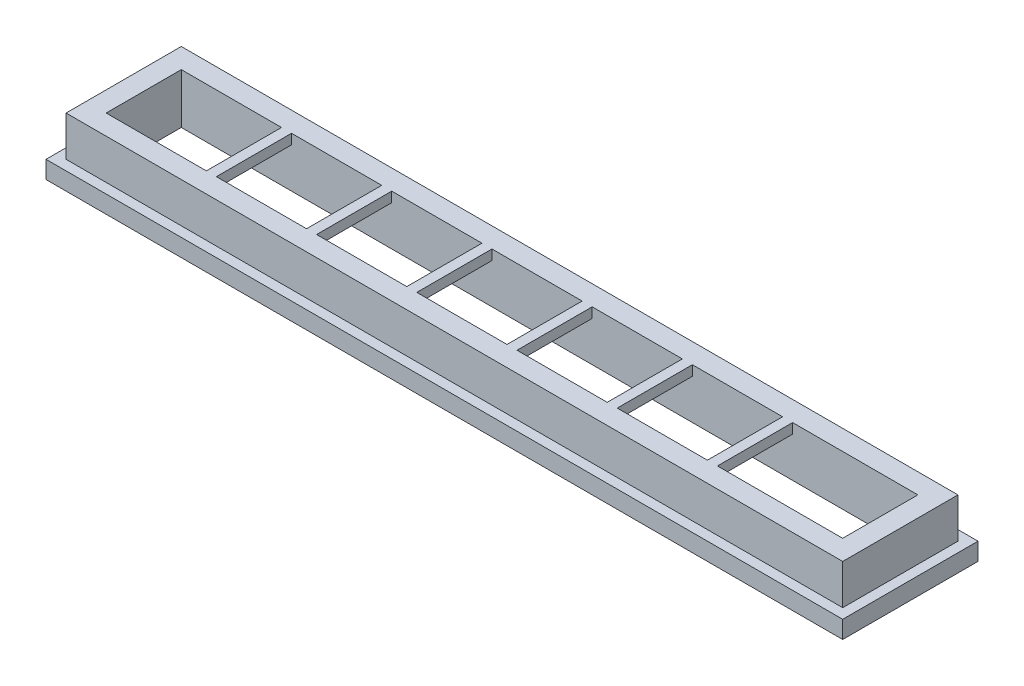
from build123d import *

# Parameters (mm, degrees)
SKIZZE1_W                            = 155
SKIZZE1_H                            = 23
SKIZZE1_W_2                          = 147
SKIZZE1_H_2                          = 15
AUFSATZ_LINEAR_AUSTRAGEN1_DEPTH      = 10
SKIZZE2_W                            = 2
SKIZZE2_H                            = 15
AUFSATZ_LINEAR_AUSTRAGEN2_DEPTH      = 2
AUFSATZ_LINEAR_AUSTRAGEN3_DEPTH      = 1.5
AUFSATZ_LINEAR_AUSTRAGEN3_DEPTH_BACK = 2
SKIZZE3_W                            = 159
SKIZZE3_H                            = 27
SKIZZE3_W_2                          = 155
SKIZZE3_H_2                          = 23


with BuildPart() as part:
    # Skizze1 → Aufsatz-Linear austragen1 (new body)
    with BuildSketch(Plane(origin=(0, 0, 0), x_dir=(1, 0, 0), z_dir=(0, 1, 0))):
        Rectangle(SKIZZE1_W, SKIZZE1_H)
        Rectangle(SKIZZE1_W_2, SKIZZE1_H_2, mode=Mode.SUBTRACT)
    extrude(amount=AUFSATZ_LINEAR_AUSTRAGEN1_DEPTH)

    # Skizze2 → Aufsatz-Linear austragen2 (add)
    with BuildSketch(Plane(origin=(0, 10, 0), x_dir=(1, 0, 0), z_dir=(0, 1, 0))):
        with Locations((-52.5, 0)):
            Rectangle(SKIZZE2_W, SKIZZE2_H)
        with Locations((-32.5, 0)):
            Rectangle(SKIZZE2_W, SKIZZE2_H)
        with Locations((-12.5, 0)):
            Rectangle(SKIZZE2_W, SKIZZE2_H)
        with Locations((7.5, 0)):
            Rectangle(SKIZZE2_W, SKIZZE2_H)
        with Locations((27.5, 0)):
            Rectangle(SKIZZE2_W, SKIZZE2_H)
        with Locations((47.5, 0)):
            Rectangle(SKIZZE2_W, SKIZZE2_H)
    extrude(amount=-AUFSATZ_LINEAR_AUSTRAGEN2_DEPTH)

    # Skizze3 → Aufsatz-Linear austragen3 (add, two sides: drawn at the far end of the back side and taken through both)
    with BuildSketch(Plane.XZ.offset(-AUFSATZ_LINEAR_AUSTRAGEN3_DEPTH_BACK)):
        Rectangle(SKIZZE3_W, SKIZZE3_H)
        Rectangle(SKIZZE3_W_2, SKIZZE3_H_2, mode=Mode.SUBTRACT)
    extrude(amount=AUFSATZ_LINEAR_AUSTRAGEN3_DEPTH + AUFSATZ_LINEAR_AUSTRAGEN3_DEPTH_BACK)


solid = part.part
